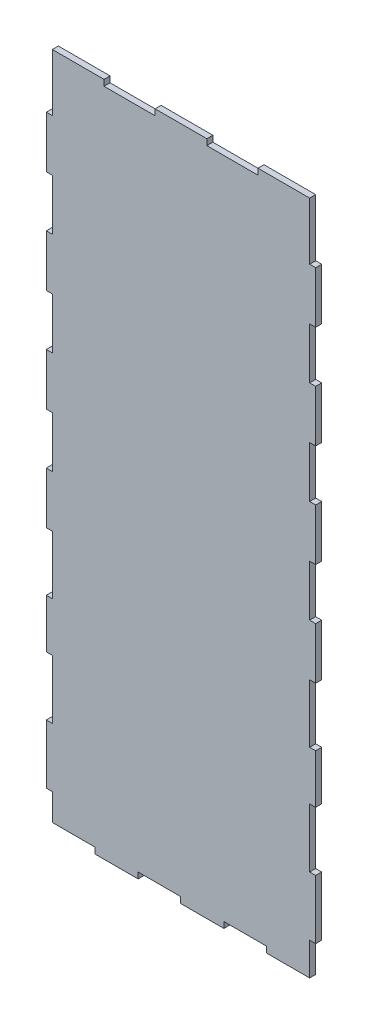
from build123d import *

# Parameters (mm, degrees)
BOSS_EXTRUDE1_DEPTH = 3


with BuildPart() as part:
    # Sketch1 → Boss-Extrude1 (new body)
    with BuildSketch(Plane.XY):
        Polygon((64.15, 153.019232641), (64.15, 178.481870793), (67.15, 178.481870793), (67.15, 204.244508944), (64.15, 204.244508944), (64.15, 229.707147096), (67.15, 229.707147096), (67.15, 255.469785247), (64.15, 255.469785247), (64.15, 280.932423398), (67.15, 280.932423398), (67.15, 306.69506155), (64.15, 306.69506155), (64.15, 335.261916889), (38.37, 335.261916889), (38.37, 332.261916889), (12.89, 332.261916889), (12.89, 335.261916889), (-12.89, 335.261916889), (-12.89, 332.261916889), (-38.37, 332.261916889), (-38.37, 335.261916889), (-64.15, 335.261916889), (-64.15, 306.69506155), (-67.15, 306.69506155), (-67.15, 280.932423398), (-64.15, 280.932423398), (-64.15, 255.469785247), (-67.15, 255.469785247), (-67.15, 229.707147096), (-64.15, 229.707147096), (-64.15, 204.244508944), (-67.15, 204.244508944), (-67.15, 178.481870793), (-64.15, 178.481870793), (-64.15, 153.019232641), (-67.15, 153.019232641), (-67.15, 127.25659449), (-64.15, 127.25659449), (-64.15, 98.12172779), (-67.15, 98.12172779), (-67.15, 73.67315636), (-64.15, 73.67315636), (-64.15, 44.27458493), (-67.15, 44.27458493), (-67.15, 14.8260135), (-64.15, 14.8260135), (-64.15, 1.5), (-42.916666667, 1.5), (-42.916666667, -1.5), (-21.383333333, -1.5), (-21.383333333, 1.5), (-0.15, 1.5), (-0.15, -1.5), (21.383333333, -1.5), (21.383333333, 1.5), (42.616666667, 1.5), (42.616666667, -1.5), (64.15, -1.5), (64.15, 14.8260135), (67.15, 14.8260135), (67.15, 44.27458493), (64.15, 44.27458493), (64.15, 73.67315636), (67.15, 73.67315636), (67.15, 98.12172779), (64.15, 98.12172779), (64.15, 127.25659449), (67.15, 127.25659449), (67.15, 153.019232641), align=None)
    extrude(amount=BOSS_EXTRUDE1_DEPTH)


solid = part.part
